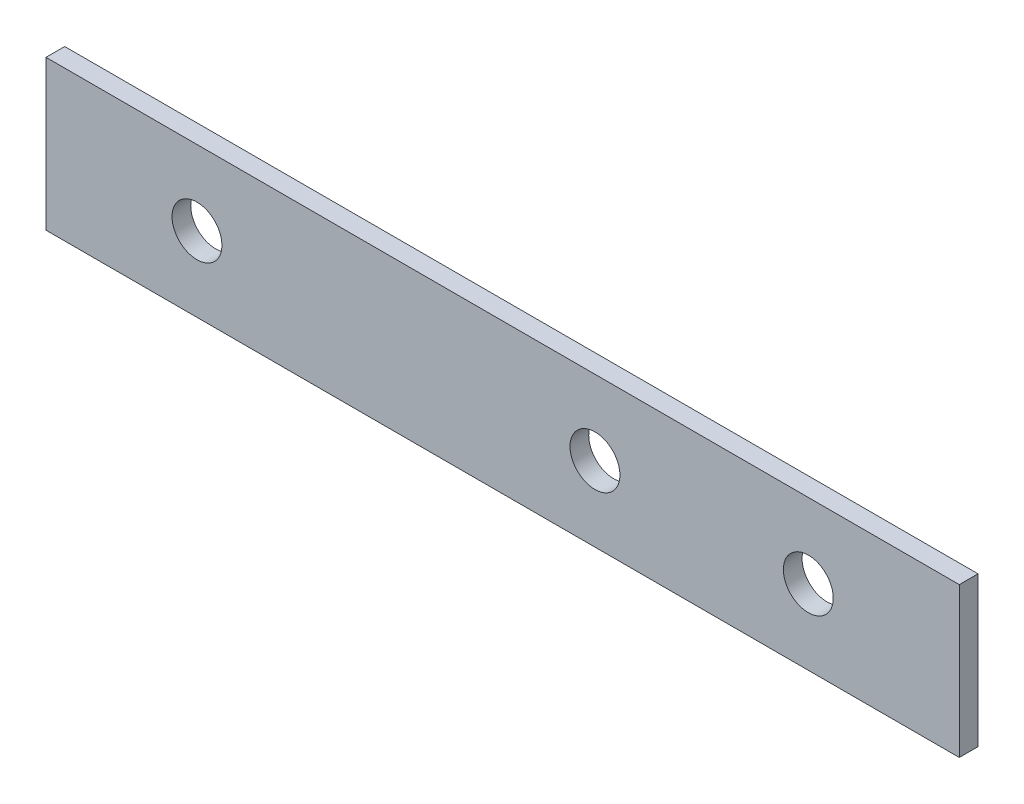
from build123d import *

# Parameters (mm, degrees)
SKETCH1_W           = 232.41
SKETCH1_H           = 38.1
SKETCH1_R           = 6.35
BOSS_EXTRUDE1_DEPTH = 4.7625


with BuildPart() as part:
    # Sketch1 → Boss-Extrude1 (new body)
    with BuildSketch(Plane.XY):
        with Locations((116.205, 19.05)):
            Rectangle(SKETCH1_W, SKETCH1_H)
        with Locations(Location((38.4175, 19.05, 0), (0, 0, 180))):
            Circle(SKETCH1_R, mode=Mode.SUBTRACT)
        with Locations(Location((193.9925, 19.05, 0), (0, 0, 180))):
            Circle(SKETCH1_R, mode=Mode.SUBTRACT)
        with Locations(Location((139.7, 19.05, 0), (0, 0, 180))):
            Circle(SKETCH1_R, mode=Mode.SUBTRACT)
    extrude(amount=BOSS_EXTRUDE1_DEPTH)


solid = part.part
